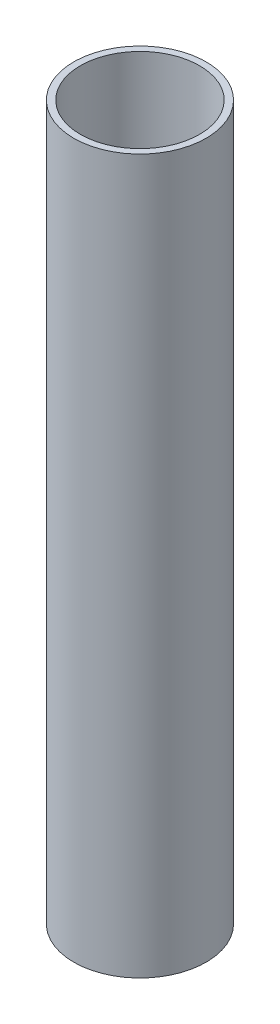
from build123d import *

# Parameters (mm, degrees)
SKETCH1_R           = 10
SKETCH1_R_2         = 9
BOSS_EXTRUDE1_DEPTH = 107.8


with BuildPart() as part:
    # Sketch1 → Boss-Extrude1 (new body)
    with BuildSketch(Plane(origin=(0, 0, 0), x_dir=(1, 0, 0), z_dir=(0, 1, 0))):
        with Locations(Location((0, 0, 0), (0, 0, 270))):
            Circle(SKETCH1_R)
        with Locations(Location((0, 0, 0), (0, 0, 270))):
            Circle(SKETCH1_R_2, mode=Mode.SUBTRACT)
    extrude(amount=BOSS_EXTRUDE1_DEPTH)


solid = part.part
